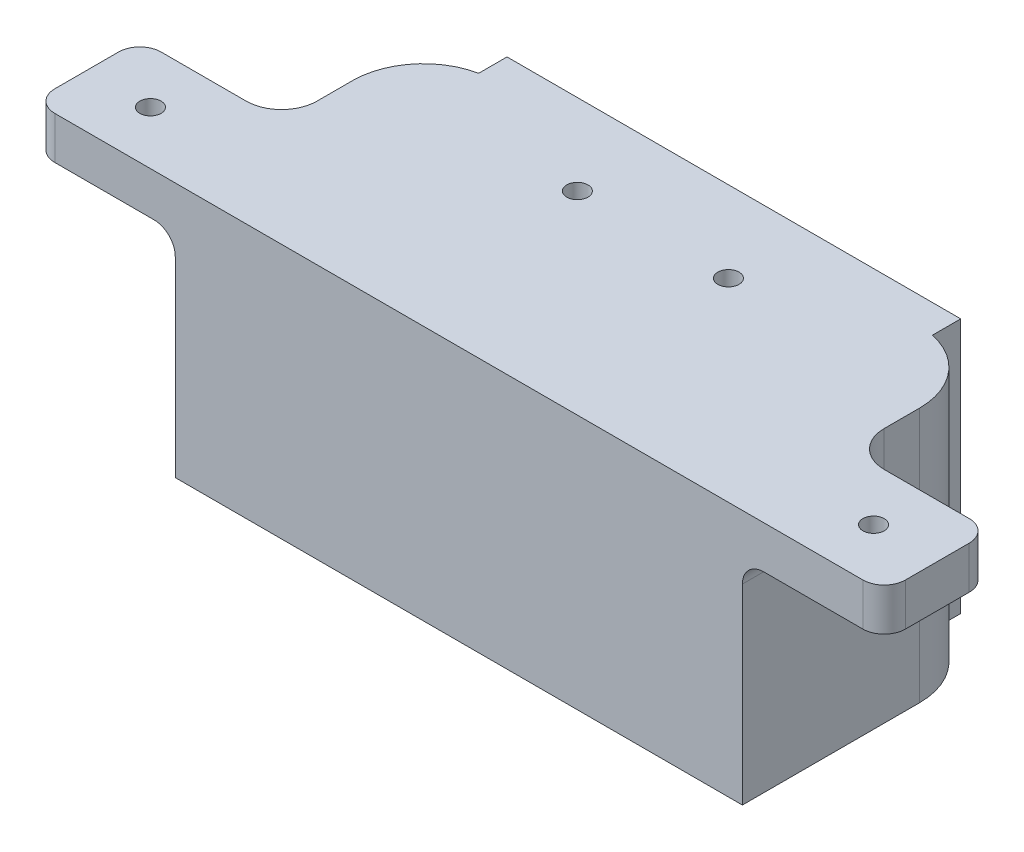
from build123d import *

# Parameters (mm, degrees)
SALIENTE_EXTRUIR1_DEPTH    = 30
SALIENTE_EXTRUIR2_START    = -30
SALIENTE_EXTRUIR2_DEPTH    = 30
CORTAR_EXTRUIR2_DEPTH      = 56.901699437
CORTAR_EXTRUIR2_DEPTH_BACK = 56.901699437
CORTAR_EXTRUIR3_START      = -30
CORTAR_EXTRUIR3_DEPTH      = 30
SALIENTE_EXTRUIR3_DEPTH    = 6
CROQUIS13_R                = 1.5
CORTAR_EXTRUIR6_DEPTH      = 75.303431953
REDONDEO3_R                = 3
REDONDEO4_R                = 3


with BuildPart() as part:
    # Croquis1 → Saliente-Extruir1 (new body)
    with BuildSketch(Plane(origin=(0, 0, 0), x_dir=(1, 0, 0), z_dir=(0, 1, 0))):
        with BuildLine():
            Line((40, -25), (40, 0))
            ThreePointArc((40, 0), (32.043096437, 9.789063129), (20.83484861, 4))
            Line((20.83484861, 4), (11.313708499, 4))
            ThreePointArc((11.313708499, 4), (0, 12), (-11.313708499, 4))
            Line((-11.313708499, 4), (-20.83484861, 4))
            ThreePointArc((-20.83484861, 4), (-32.043096437, 9.789063129), (-40, 0))
            Line((-40, 0), (-40, -25))
            Line((-40, -25), (40, -25))
        make_face()
    extrude(amount=SALIENTE_EXTRUIR1_DEPTH)

    # Croquis3 → Saliente-Extruir2 (add)
    with BuildSketch(Plane(origin=(0, 30, 0), x_dir=(1, 0, 0), z_dir=(0, 1, 0)).offset(SALIENTE_EXTRUIR2_START)):
        with BuildLine():
            Line((-32, 9.797958971), (-32, 13.797958971))
            Line((-32, 13.797958971), (-28, 13.797958971))
            Line((-28, 13.797958971), (-28, 9.797958971))
            ThreePointArc((-28, 9.797958971), (-30, 10), (-32, 9.797958971))
        make_face()
        with BuildLine():
            Line((28, 9.797958971), (28, 13.797958971))
            Line((28, 13.797958971), (32, 13.797958971))
            Line((32, 13.797958971), (32, 9.797958971))
            ThreePointArc((32, 9.797958971), (30, 10), (28, 9.797958971))
        make_face()
    extrude(amount=SALIENTE_EXTRUIR2_DEPTH)

    # Croquis4 → Cortar-Extruir2 (cut, two sides: drawn at the far end of the back side and taken through both)
    with BuildSketch(Plane(origin=(0, 30, 0), x_dir=(1, 0, 0), z_dir=(0, 1, 0)).offset(-CORTAR_EXTRUIR2_DEPTH_BACK)):
        with BuildLine():
            Line((-30.5, 7.483314774), (-30.5, 14.654769407))
            Line((-30.5, 14.654769407), (-29.5, 14.654769407))
            Line((-29.5, 14.654769407), (-29.5, 7.483314774))
            ThreePointArc((-29.5, 7.483314774), (-30, -7.5), (-30.5, 7.483314774))
        make_face()
        with BuildLine():
            Line((29.5, 7.483314774), (29.5, 14.654769407))
            Line((29.5, 14.654769407), (30.5, 14.654769407))
            Line((30.5, 14.654769407), (30.5, 7.483314774))
            ThreePointArc((30.5, 7.483314774), (30, -7.5), (29.5, 7.483314774))
        make_face()
    extrude(amount=CORTAR_EXTRUIR2_DEPTH + CORTAR_EXTRUIR2_DEPTH_BACK, mode=Mode.SUBTRACT)

    # Croquis5 → Cortar-Extruir3 (cut)
    with BuildSketch(Plane(origin=(0, 30, 0), x_dir=(1, 0, 0), z_dir=(0, 1, 0)).offset(CORTAR_EXTRUIR3_START)):
        with BuildLine():
            Line((-20, 0), (-20, -10))
            Line((-20, -10), (20, -10))
            Line((20, -10), (20, 0))
            ThreePointArc((20, 0), (20.210936871, 2.043096437), (20.83484861, 4))
            Line((20.83484861, 4), (20.83484861, 13.99599321))
            Line((20.83484861, 13.99599321), (-20.83484861, 13.99599321))
            Line((-20.83484861, 13.99599321), (-20.83484861, 4))
            ThreePointArc((-20.83484861, 4), (-20.210936871, 2.043096437), (-20, 0))
        make_face()
    extrude(amount=CORTAR_EXTRUIR3_DEPTH, mode=Mode.SUBTRACT)

    # Croquis12 → Saliente-Extruir3 (add)
    with BuildSketch(Plane(origin=(0, 30, 0), x_dir=(1, 0, 0), z_dir=(0, 1, 0))):
        with BuildLine():
            Line((40, -25), (-40, -25))
            Line((-40, -25), (-57, -25))
            ThreePointArc((-57, -25), (-59.121320344, -24.121320344), (-60, -22))
            Line((-60, -22), (-60, -13))
            ThreePointArc((-60, -13), (-59.121320344, -10.878679656), (-57, -10))
            Line((-57, -10), (-45, -10))
            ThreePointArc((-45, -10), (-41.464466094, -8.535533906), (-40, -5))
            Line((-40, -5), (-40, 0))
            ThreePointArc((-40, 0), (-37.745966692, 6.32455532), (-32, 9.797958971))
            Line((-32, 9.797958971), (-32, 13.797958971))
            Line((-32, 13.797958971), (32, 13.797958971))
            Line((32, 13.797958971), (32, 9.797958971))
            ThreePointArc((32, 9.797958971), (37.745966692, 6.32455532), (40, 0))
            Line((40, 0), (40, -5))
            ThreePointArc((40, -5), (41.464466094, -8.535533906), (45, -10))
            Line((45, -10), (57, -10))
            ThreePointArc((57, -10), (59.121320344, -10.878679656), (60, -13))
            Line((60, -13), (60, -22))
            ThreePointArc((60, -22), (59.121320344, -24.121320344), (57, -25))
            Line((57, -25), (40, -25))
        make_face()
    extrude(amount=SALIENTE_EXTRUIR3_DEPTH)

    # Croquis13 → Cortar-Extruir6 (cut, through all)
    with BuildSketch(Plane(origin=(0, 36, 0), x_dir=(1, 0, 0), z_dir=(0, 1, 0))):
        with Locations(Location((51, -17.5, 0), (0, 0, 270))):
            Circle(CROQUIS13_R)
        with Locations(Location((-51, -17.5, 0), (0, 0, 90))):
            Circle(CROQUIS13_R)
        with Locations(Location((-10.655547213, 2.375143361, 0), (0, 0, 270))):
            Circle(CROQUIS13_R)
        with Locations(Location((10.655547213, 2.375143361, 0), (0, 0, 90))):
            Circle(CROQUIS13_R)
    extrude(amount=-CORTAR_EXTRUIR6_DEPTH, mode=Mode.SUBTRACT)

    # Redondeo3
    redondeo3_edges = [part.edges().sort_by_distance(p)[0] for p in [
        (40, 30, 15),
    ]]
    fillet(redondeo3_edges, radius=REDONDEO3_R)

    # Redondeo4
    redondeo4_edges = [part.edges().sort_by_distance(p)[0] for p in [
        (-40, 30, 15),
    ]]
    fillet(redondeo4_edges, radius=REDONDEO4_R)


solid = part.part
